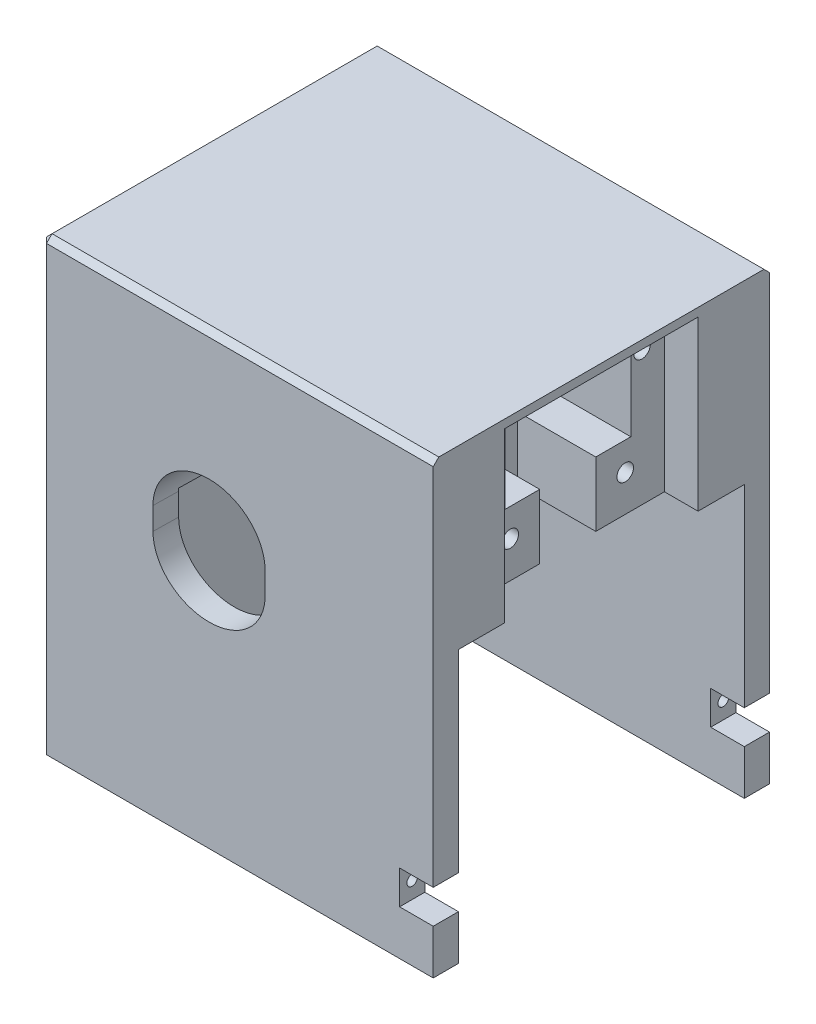
from build123d import *

# Parameters (mm, degrees)
SKETCH_1_W                = 70
SKETCH_1_H                = 60
EXTRUDE_1_DEPTH           = 80
SKETCH_2_W                = 51
SKETCH_2_H                = 48.5
CUT_EXTRUDE_1_DEPTH       = 65.5
CUT_EXTRUDE_2_DEPTH       = 106.948100502
CUT_EXTRUDE_2_TAPER       = 1
SKETCH_4_W                = 20.5
SKETCH_4_H                = 15.5
CUT_EXTRUDE_3_DEPTH       = 41
CUT_EXTRUDE_4_DEPTH       = 15.5
CUT_EXTRUDE_4_DEPTH_BACK  = 21
SKETCH_5_R                = 10
SKETCH_6_W                = 10
SKETCH_6_H                = 29
CUT_EXTRUDE_5_DEPTH       = 20
SKETCH_7_W                = 32.5
SKETCH_7_H                = 30
SKETCH_7_W_2              = 4.5
SKETCH_7_H_2              = 6
CUT_EXTRUDE_6_DEPTH       = 6
CUT_EXTRUDE_10_DEPTH      = 16
CUT_EXTRUDE_10_DEPTH_BACK = 16
SKETCH_13_R               = 11
CUT_EXTRUDE_7_DEPTH       = 108.658023552
SKETCH_9_R                = 1.475
CUT_EXTRUDE_8_DEPTH       = 10
CHAMFER_3_SIZE            = 1
SKETCH_10_W               = 1
SKETCH_10_H               = 30
CUT_EXTRUDE_9_DEPTH       = 6
CUT_EXTRUDE_11_DEPTH      = 36
SKETCH_15_R               = 0.95
CUT_EXTRUDE_12_DEPTH      = 5


with BuildPart() as part:
    # 草图1 → 凸台-拉伸1 (new body)
    with BuildSketch(Plane(origin=(0, 0, 0), x_dir=(1, 0, 0), z_dir=(0, 1, 0))):
        Rectangle(SKETCH_1_W, SKETCH_1_H)
    extrude(amount=EXTRUDE_1_DEPTH)

    # 草图2 → 切除-拉伸1 (cut)
    with BuildSketch(Plane(origin=(35, 0, 0), x_dir=(0, 0, -1), z_dir=(1, 0, 0))):
        with Locations((0, 24.25)):
            Rectangle(SKETCH_2_W, SKETCH_2_H)
    extrude(amount=-CUT_EXTRUDE_1_DEPTH, mode=Mode.SUBTRACT)

    # 草图3 → 切除-拉伸2 (cut, through all)
    with BuildSketch(Plane.XY.offset(30)):
        with BuildLine():
            Line((-15, 48), (-15, 44))
            add(Edge.make_bspline(
                [(-15, 44), (-15, 35), (-5, 35), (5, 35), (5, 44)],
                knots=[3.141592654, 3.141592654, 3.141592654, 4.71238898, 4.71238898, 6.283185307, 6.283185307, 6.283185307], degree=2, weights=[1, 0.707106781, 1, 0.707106781, 1]))
            Line((5, 44), (5, 48))
            add(Edge.make_bspline(
                [(5, 48), (5, 57.090909091), (-5, 57.090909091), (-15, 57.090909091), (-15, 48)],
                knots=[0, 0, 0, 1.570796327, 1.570796327, 3.141592654, 3.141592654, 3.141592654], degree=2, weights=[1, 0.707106781, 1, 0.707106781, 1]))
        make_face()
    extrude(amount=-CUT_EXTRUDE_2_DEPTH, taper=CUT_EXTRUDE_2_TAPER, mode=Mode.SUBTRACT)

    # 草图4 → 切除-拉伸3 (cut)
    with BuildSketch(Plane(origin=(35, 0, 0), x_dir=(0, 0, -1), z_dir=(1, 0, 0))):
        with Locations((0, 70.75)):
            Rectangle(SKETCH_4_W, SKETCH_4_H)
    extrude(amount=-CUT_EXTRUDE_3_DEPTH, mode=Mode.SUBTRACT)

    # 草图5 → 切除-拉伸4 (cut, two sides: drawn at the far end of the back side and taken through both)
    with BuildSketch(Plane(origin=(0, 63, 0), x_dir=(1, 0, 0), z_dir=(0, 1, 0)).offset(-CUT_EXTRUDE_4_DEPTH_BACK)):
        with Locations(Location((-6, 0, 0), (0, 0, 90))):
            Circle(SKETCH_5_R)
    extrude(amount=CUT_EXTRUDE_4_DEPTH + CUT_EXTRUDE_4_DEPTH_BACK, mode=Mode.SUBTRACT)

    # 草图6 → 切除-拉伸5 (cut)
    with BuildSketch(Plane(origin=(35, 0, 0), x_dir=(0, 0, -1), z_dir=(1, 0, 0))):
        with Locations((0, 48.5)):
            Rectangle(SKETCH_6_W, SKETCH_6_H)
    extrude(amount=-CUT_EXTRUDE_5_DEPTH, mode=Mode.SUBTRACT)

    # 草图7 → 切除-拉伸6 (cut)
    with BuildSketch(Plane(origin=(35, 0, 0), x_dir=(0, 0, -1), z_dir=(1, 0, 0))):
        with Locations((0, 63.5)):
            Rectangle(SKETCH_7_W, SKETCH_7_H)
        with Locations((27.75, 11)):
            Rectangle(SKETCH_7_W_2, SKETCH_7_H_2)
        with Locations((-27.75, 11)):
            Rectangle(SKETCH_7_W_2, SKETCH_7_H_2)
    extrude(amount=-CUT_EXTRUDE_6_DEPTH, mode=Mode.SUBTRACT)

    # 草图13 → 切除-拉伸10 (cut, two sides: drawn at the far end of the back side and taken through both)
    with BuildSketch(Plane(origin=(0, 63, 0), x_dir=(1, 0, 0), z_dir=(0, 1, 0)).offset(-CUT_EXTRUDE_10_DEPTH_BACK)):
        with Locations(Location((-6, 0, 0), (0, 0, 139.260992564))):
            Circle(SKETCH_13_R)
    extrude(amount=CUT_EXTRUDE_10_DEPTH + CUT_EXTRUDE_10_DEPTH_BACK, mode=Mode.SUBTRACT)

    # 草图8 → 切除-拉伸7 (cut, through all)
    with BuildSketch(Plane(origin=(-30.5, 0, 0), x_dir=(0, 0, -1), z_dir=(1, 0, 0))):
        with BuildLine():
            Line((-10.5, 21), (-10.5, 5))
            ThreePointArc((-10.5, 5), (-14, 1.5), (-17.5, 5))
            Line((-17.5, 5), (-17.5, 21))
            ThreePointArc((-17.5, 21), (-14, 24.5), (-10.5, 21))
        make_face()
        with BuildLine():
            Line((10.5, 21), (10.5, 5))
            ThreePointArc((10.5, 5), (14, 1.5), (17.5, 5))
            Line((17.5, 5), (17.5, 21))
            ThreePointArc((17.5, 21), (14, 24.5), (10.5, 21))
        make_face()
    extrude(amount=-CUT_EXTRUDE_7_DEPTH, mode=Mode.SUBTRACT)

    # 草图9 → 切除-拉伸8 (cut)
    with BuildSketch(Plane(origin=(29, 0, 0), x_dir=(0, 0, -1), z_dir=(1, 0, 0))):
        with Locations((-13.25, 72.5)):
            Circle(SKETCH_9_R)
        with Locations((-10.25, 55)):
            Circle(SKETCH_9_R)
        with Locations(Location((10.25, 55, 0), (0, 0, 180))):
            Circle(SKETCH_9_R)
        with Locations(Location((13.25, 72.5, 0), (0, 0, 180))):
            Circle(SKETCH_9_R)
    extrude(amount=-CUT_EXTRUDE_8_DEPTH, mode=Mode.SUBTRACT)

    # 倒角3
    chamfer_3_edges = [part.edges().sort_by_distance(p)[0] for p in [
        (-35, 80, 0),
        (0, 80, 30),
        (0, 80, -30),
        (-35, 40, 30),
        (-35, 40, -30),
    ]]
    chamfer(chamfer_3_edges, length=CHAMFER_3_SIZE)

    # 草图10 → 切除-拉伸9 (cut)
    with BuildSketch(Plane(origin=(35, 0, 0), x_dir=(0, 0, -1), z_dir=(1, 0, 0))):
        with Locations((-16.75, 63.5)):
            Rectangle(SKETCH_10_W, SKETCH_10_H)
        with Locations((16.75, 63.5)):
            Rectangle(SKETCH_10_W, SKETCH_10_H)
    extrude(amount=-CUT_EXTRUDE_9_DEPTH, mode=Mode.SUBTRACT)

    # 草图14 → 切除-拉伸11 (cut)
    with BuildSketch(Plane(origin=(29, 0, 0), x_dir=(0, 0, -1), z_dir=(1, 0, 0))):
        Polygon((-11.232743219, 78.5), (-10.232743219, 78.5), (-10.232743219, 63), (10.25, 63), (10.25, 78.5), (11.25, 78.5), (11.25, 63), (11.25, 60), (-11.232743219, 60), (-11.232743219, 63), align=None)
    extrude(amount=-CUT_EXTRUDE_11_DEPTH, mode=Mode.SUBTRACT)

    # 草图15 → 切除-拉伸12 (cut)
    with BuildSketch(Plane(origin=(29, 0, 0), x_dir=(0, 0, -1), z_dir=(1, 0, 0))):
        with Locations((-27.752668803, 11)):
            Circle(SKETCH_15_R)
        with Locations((27.75, 11)):
            Circle(SKETCH_15_R)
    extrude(amount=-CUT_EXTRUDE_12_DEPTH, mode=Mode.SUBTRACT)


solid = part.part
